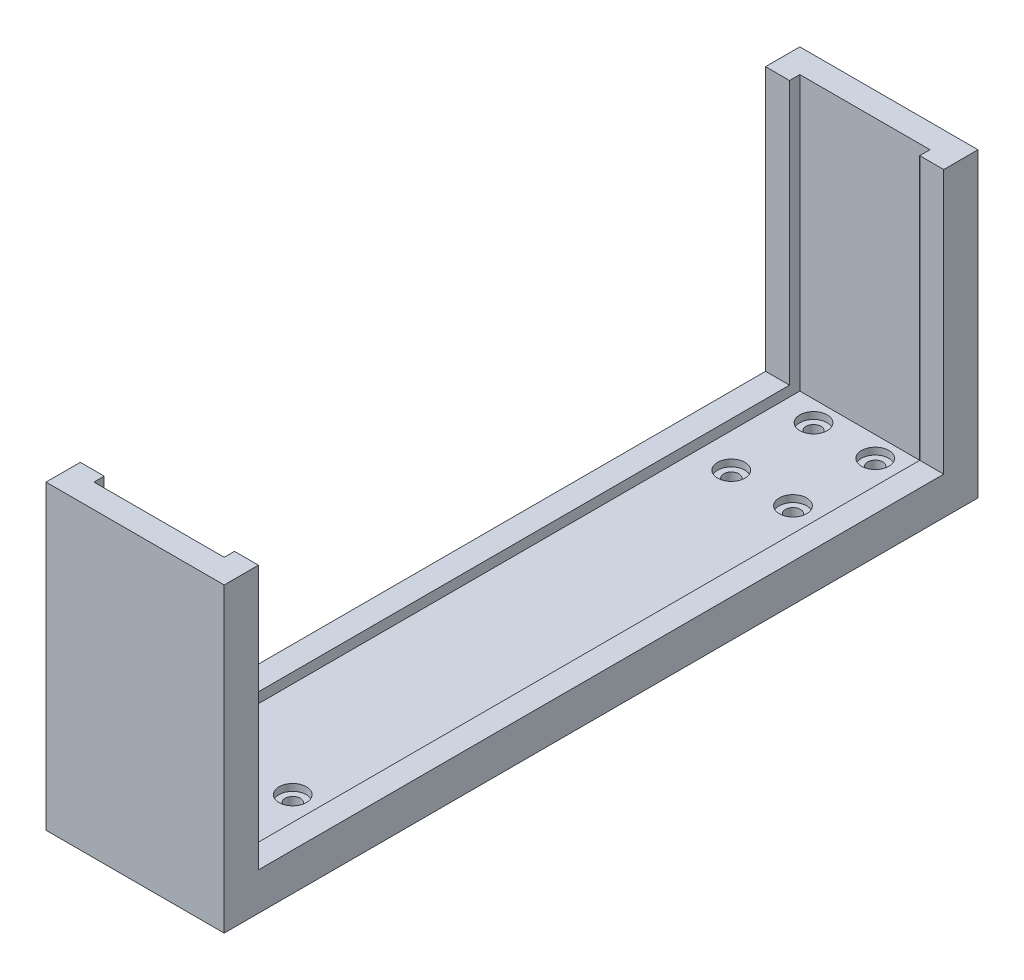
from build123d import *

# Parameters (mm, degrees)
SKETCH1_W           = 52
SKETCH1_H           = 220
BOSS_EXTRUDE1_DEPTH = 8
SKETCH2_W           = 7
SKETCH2_H           = 220
BOSS_EXTRUDE2_DEPTH = 80
SKETCH3_W           = 45
SKETCH3_H           = 7
BOSS_EXTRUDE3_DEPTH = 80
SKETCH4_W           = 45
SKETCH4_H           = 7
BOSS_EXTRUDE4_DEPTH = 80
SKETCH8_W           = 200
SKETCH8_H           = 80
CUT_EXTRUDE3_DEPTH  = 10
SKETCH10_R          = 2.2
CUT_EXTRUDE5_DEPTH  = 8
SKETCH11_W          = 7
SKETCH11_H          = 206
SKETCH11_H_2        = 200
BOSS_EXTRUDE6_DEPTH = 3
SKETCH12_W          = 7
SKETCH12_H          = 3
BOSS_EXTRUDE7_DEPTH = 77
SKETCH13_R          = 4
CUT_EXTRUDE6_DEPTH  = 2


with BuildPart() as part:
    # Sketch1 → Boss-Extrude1 (new body)
    with BuildSketch(Plane(origin=(0, 0, 0), x_dir=(1, 0, 0), z_dir=(0, 1, 0))):
        with Locations((33.761174554, -57.057839406)):
            Rectangle(SKETCH1_W, SKETCH1_H)
    extrude(amount=BOSS_EXTRUDE1_DEPTH)

    # Sketch2 → Boss-Extrude2 (add)
    with BuildSketch(Plane(origin=(0, 8, 0), x_dir=(1, 0, 0), z_dir=(0, 1, 0))):
        with Locations((11.261174554, -57.057839406)):
            Rectangle(SKETCH2_W, SKETCH2_H)
    extrude(amount=BOSS_EXTRUDE2_DEPTH)

    # Sketch3 → Boss-Extrude3 (add)
    with BuildSketch(Plane(origin=(0, 8, 0), x_dir=(1, 0, 0), z_dir=(0, 1, 0))):
        with Locations((37.261174554, -163.557839406)):
            Rectangle(SKETCH3_W, SKETCH3_H)
    extrude(amount=BOSS_EXTRUDE3_DEPTH)

    # Sketch4 → Boss-Extrude4 (add)
    with BuildSketch(Plane(origin=(0, 8, 0), x_dir=(1, 0, 0), z_dir=(0, 1, 0))):
        with Locations((37.261174554, 49.442160594)):
            Rectangle(SKETCH4_W, SKETCH4_H)
    extrude(amount=BOSS_EXTRUDE4_DEPTH)

    # Sketch8 → Cut-Extrude3 (cut)
    with BuildSketch(Plane.ZY.offset(-7.761174554)):
        with Locations((57.057839406, 48)):
            Rectangle(SKETCH8_W, SKETCH8_H)
    extrude(amount=-CUT_EXTRUDE3_DEPTH, mode=Mode.SUBTRACT)

    # Sketch10 → Cut-Extrude5 (cut)
    with BuildSketch(Plane.XZ):
        with Locations(Location((24.761174554, 154.057839406, 0), (0, 0, 270))):
            Circle(SKETCH10_R)
        with Locations(Location((42.761174554, 154.057839406, 0), (0, 0, 270))):
            Circle(SKETCH10_R)
        with Locations(Location((42.761174554, 130.057839406, 0), (0, 0, 270))):
            Circle(SKETCH10_R)
        with Locations(Location((24.761174554, 130.057839406, 0), (0, 0, 270))):
            Circle(SKETCH10_R)
        with Locations(Location((24.761174554, -15.942160594, 0), (0, 0, 270))):
            Circle(SKETCH10_R)
        with Locations(Location((42.761174554, -15.942160594, 0), (0, 0, 270))):
            Circle(SKETCH10_R)
        with Locations(Location((42.761174554, -39.942160594, 0), (0, 0, 270))):
            Circle(SKETCH10_R)
        with Locations(Location((24.761174554, -39.942160594, 0), (0, 0, 270))):
            Circle(SKETCH10_R)
    extrude(amount=-CUT_EXTRUDE5_DEPTH, mode=Mode.SUBTRACT)

    # Sketch11 → Boss-Extrude6 (add)
    with BuildSketch(Plane(origin=(0, 8, 0), x_dir=(1, 0, 0), z_dir=(0, 1, 0))):
        with Locations((56.261174554, -57.057839406)):
            Rectangle(SKETCH11_W, SKETCH11_H)
        with Locations((11.261174554, -57.057839406)):
            Rectangle(SKETCH11_W, SKETCH11_H_2)
    extrude(amount=BOSS_EXTRUDE6_DEPTH)

    # Sketch12 → Boss-Extrude7 (add)
    with BuildSketch(Plane(origin=(0, 88, 0), x_dir=(1, 0, 0), z_dir=(0, 1, 0))):
        with Locations((56.261174554, 44.442160594)):
            Rectangle(SKETCH12_W, SKETCH12_H)
        with Locations((56.261174554, -158.557839406)):
            Rectangle(SKETCH12_W, SKETCH12_H)
    extrude(amount=-BOSS_EXTRUDE7_DEPTH)

    # Sketch13 → Cut-Extrude6 (cut)
    with BuildSketch(Plane(origin=(0, 8, 0), x_dir=(1, 0, 0), z_dir=(0, 1, 0))):
        with Locations(Location((42.761174554, -154.057839406, 0), (0, 0, 270))):
            Circle(SKETCH13_R)
        with Locations(Location((24.761174554, -154.057839406, 0), (0, 0, 270))):
            Circle(SKETCH13_R)
        with Locations(Location((24.761174554, -130.057839406, 0), (0, 0, 270))):
            Circle(SKETCH13_R)
        with Locations(Location((42.761174554, -130.057839406, 0), (0, 0, 270))):
            Circle(SKETCH13_R)
        with Locations(Location((42.761174554, 15.942160594, 0), (0, 0, 270))):
            Circle(SKETCH13_R)
        with Locations(Location((24.761174554, 15.942160594, 0), (0, 0, 270))):
            Circle(SKETCH13_R)
        with Locations(Location((24.761174554, 39.942160594, 0), (0, 0, 270))):
            Circle(SKETCH13_R)
        with Locations(Location((42.761174554, 39.942160594, 0), (0, 0, 270))):
            Circle(SKETCH13_R)
    extrude(amount=-CUT_EXTRUDE6_DEPTH, mode=Mode.SUBTRACT)


solid = part.part
